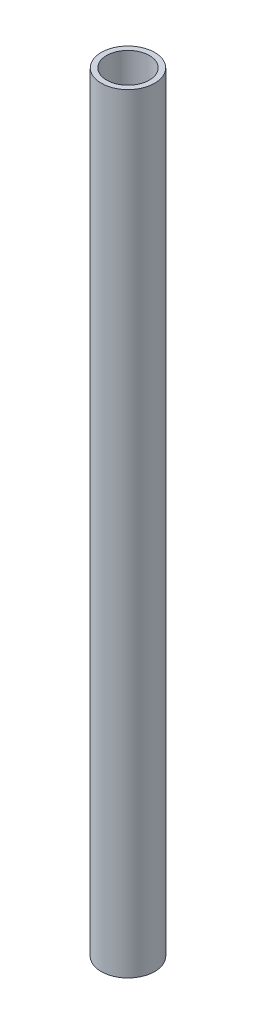
from build123d import *

# Parameters (mm, degrees)
SKETCH2_R           = 15
SKETCH2_R_2         = 12
BOSS_EXTRUDE1_DEPTH = 432


with BuildPart() as part:
    # Sketch2 → Boss-Extrude1 (new body)
    with BuildSketch(Plane(origin=(0, 0, 0), x_dir=(1, 0, 0), z_dir=(0, 1, 0))):
        with Locations(Location((0, 0, 0), (0, 0, 270))):
            Circle(SKETCH2_R)
        with Locations(Location((0, 0, 0), (0, 0, 270))):
            Circle(SKETCH2_R_2, mode=Mode.SUBTRACT)
    extrude(amount=BOSS_EXTRUDE1_DEPTH)


solid = part.part
